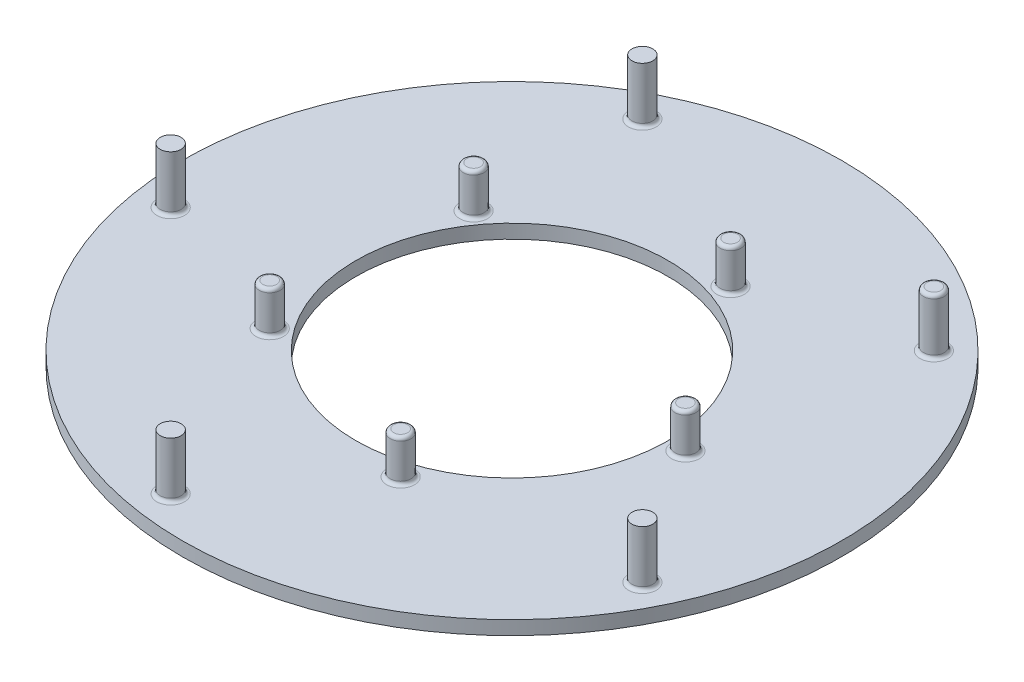
from build123d import *

# Parameters (mm, degrees)
SKETCH1_R                = 47.5
SKETCH1_R_2              = 22.5
BOSS_EXTRUDE1_DEPTH      = 2
SKETCH2_R                = 1.5
BOSS_EXTRUDE2_DEPTH      = 6
FILLET1_R                = 0.5
SKETCH3_R                = 1.5
BOSS_EXTRUDE3_DEPTH      = 2
FILLET2_R                = 0.5
CIRPATTERN1_COUNT        = 5
FILLET1_OF_CIRPATTERN1_R = 0.5


with BuildPart() as part:
    # Sketch1 → Boss-Extrude1 (new body)
    with BuildSketch(Plane(origin=(0, 0, 0), x_dir=(1, 0, 0), z_dir=(0, 1, 0))):
        with Locations(Location((0, 0, 0), (0, 0, 270))):
            Circle(SKETCH1_R)
        with Locations(Location((0, 0, 0), (0, 0, 270))):
            Circle(SKETCH1_R_2, mode=Mode.SUBTRACT)
    extrude(amount=BOSS_EXTRUDE1_DEPTH)

    # Sketch2 → Boss-Extrude2 (add)
    with BuildSketch(Plane(origin=(0, 2, 0), x_dir=(1, 0, 0), z_dir=(0, 1, 0))):
        with Locations(Location((25, 0, 0), (0, 0, 270))):
            Circle(SKETCH2_R)
        with Locations(Location((30.405591591, 30.405591591, 0), (0, 0, 270))):
            Circle(SKETCH2_R)
    boss_extrude2 = extrude(amount=BOSS_EXTRUDE2_DEPTH)

    # Fillet1
    fillet1_edges = [part.edges().sort_by_distance(p)[0] for p in [
        (25, 2, -1.5),
        (25, 8, -1.5),
        (30.405591591, 2, -31.905591591),
    ]]
    fillet(fillet1_edges, radius=FILLET1_R)

    # Sketch3 → Boss-Extrude3 (add)
    with BuildSketch(Plane(origin=(0, 8, 0), x_dir=(1, 0, 0), z_dir=(0, 1, 0))):
        with Locations(Location((30.405591591, 30.405591591, 0), (0, 0, 270))):
            Circle(SKETCH3_R)
    boss_extrude3 = extrude(amount=BOSS_EXTRUDE3_DEPTH)

    # Fillet2
    fillet2_edges = [part.edges().sort_by_distance(p)[0] for p in [
        (30.405591591, 10, -31.905591591),
    ]]
    fillet(fillet2_edges, radius=FILLET2_R)

    # CirPattern1: Boss-Extrude2, Boss-Extrude3 ×5 about axis
    cirpattern1_axis = Axis((0, 0, 0), (0, 1, 0))
    add([boss_extrude2.rotate(cirpattern1_axis, i * 360 / CIRPATTERN1_COUNT) for i in range(1, CIRPATTERN1_COUNT)])
    add([boss_extrude3.rotate(cirpattern1_axis, i * 360 / CIRPATTERN1_COUNT) for i in range(1, CIRPATTERN1_COUNT)])

    # Fillet1 of CirPattern1
    fillet1_of_cirpattern1_edges = [part.edges().sort_by_distance(p)[0] for p in [
        (6.298840085, 2, -24.239938399),
        (6.298840085, 8, -24.239938399),
        (-20.948176263, 2, -38.776806032),
        (-21.107102738, 2, -13.481105816),
        (-21.107102738, 8, -13.481105816),
        (-43.352276524, 2, 7.940207488),
        (-19.343746981, 2, 15.908156799),
        (-19.343746981, 8, 15.908156799),
        (-5.845004118, 2, 43.684124137),
        (9.152009634, 2, 23.312887416),
        (9.152009634, 8, 23.312887416),
        (39.739865315, 2, 19.058065997),
    ]]
    fillet(fillet1_of_cirpattern1_edges, radius=FILLET1_OF_CIRPATTERN1_R)


solid = part.part
